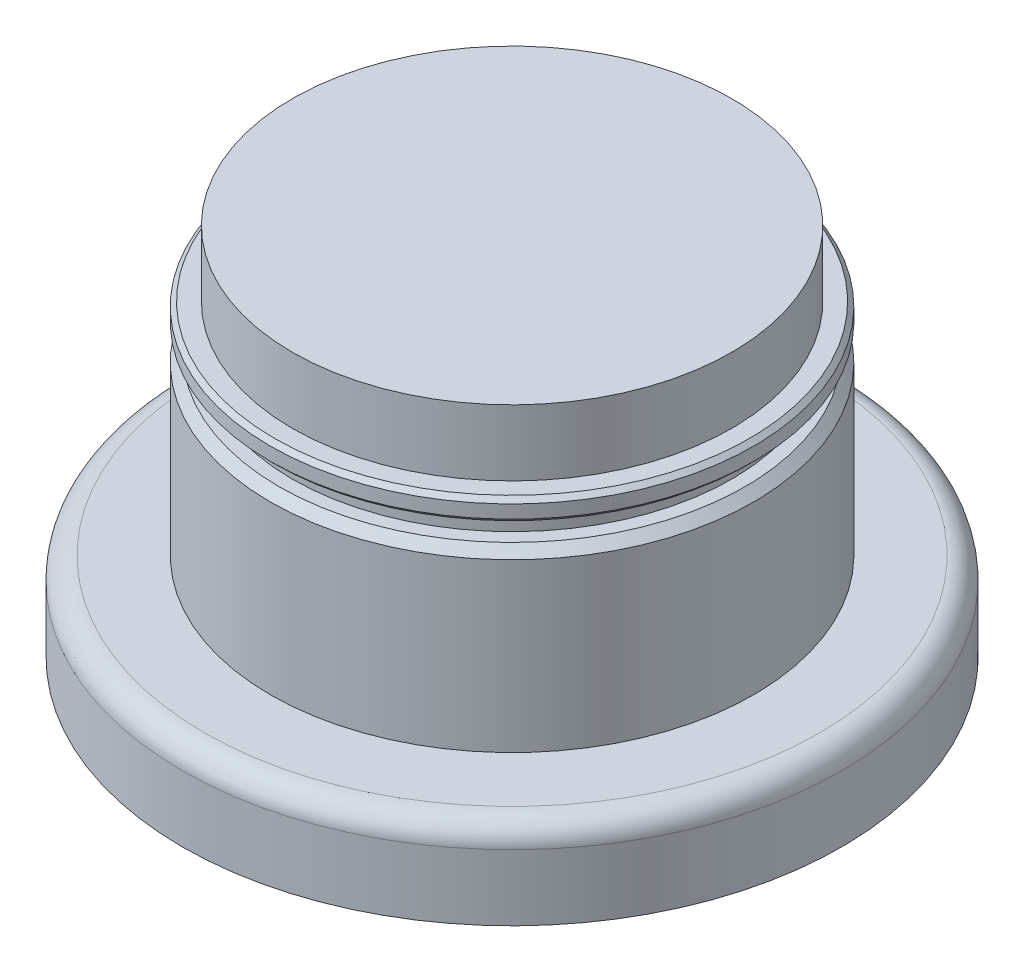
from build123d import *

# Parameters (mm, degrees)
SKETCH2_R           = 75
BOSS_EXTRUDE1_DEPTH = 20
FILLET1_R           = 5
SKETCH6_R           = 55
BOSS_EXTRUDE4_DEPTH = 40
SKETCH7_R           = 50
BOSS_EXTRUDE5_DEPTH = 5
SKETCH8_R           = 55
BOSS_EXTRUDE7_DEPTH = 5
SKETCH10_R          = 50
BOSS_EXTRUDE8_DEPTH = 15
CHAMFER7_SIZE       = 1
CHAMFER8_SIZE       = 2


with BuildPart() as part:
    # Sketch2 → Boss-Extrude1 (new body)
    with BuildSketch(Plane(origin=(0, 0, 0), x_dir=(1, 0, 0), z_dir=(0, 1, 0))):
        with Locations(Location((0, 0, 0), (0, 0, 270))):
            Circle(SKETCH2_R)
    extrude(amount=BOSS_EXTRUDE1_DEPTH)

    # Fillet1
    fillet1_edges = [part.edges().sort_by_distance(p)[0] for p in [
        (0, 20, -75),
    ]]
    fillet(fillet1_edges, radius=FILLET1_R)

    # Sketch6 → Boss-Extrude4 (add)
    with BuildSketch(Plane(origin=(0, 20, 0), x_dir=(1, 0, 0), z_dir=(0, 1, 0))):
        with Locations(Location((0, 0, 0), (0, 0, 270))):
            Circle(SKETCH6_R)
    extrude(amount=BOSS_EXTRUDE4_DEPTH)

    # Sketch7 → Boss-Extrude5 (add)
    with BuildSketch(Plane(origin=(0, 60, 0), x_dir=(1, 0, 0), z_dir=(0, 1, 0))):
        with Locations(Location((0, 0, 0), (0, 0, 270))):
            Circle(SKETCH7_R)
    extrude(amount=BOSS_EXTRUDE5_DEPTH)

    # Sketch8 → Boss-Extrude7 (add)
    with BuildSketch(Plane(origin=(0, 65, 0), x_dir=(1, 0, 0), z_dir=(0, 1, 0))):
        with Locations(Location((0, 0, 0), (0, 0, 270))):
            Circle(SKETCH8_R)
    extrude(amount=BOSS_EXTRUDE7_DEPTH)

    # Sketch10 → Boss-Extrude8 (add)
    with BuildSketch(Plane(origin=(0, 70, 0), x_dir=(1, 0, 0), z_dir=(0, 1, 0))):
        with Locations(Location((0, 0, 0), (0, 0, 270))):
            Circle(SKETCH10_R)
    extrude(amount=BOSS_EXTRUDE8_DEPTH)

    # Chamfer7
    chamfer7_edges = [part.edges().sort_by_distance(p)[0] for p in [
        (0, 65, -55),
        (0, 70, -55),
    ]]
    chamfer(chamfer7_edges, length=CHAMFER7_SIZE)

    # Chamfer8
    chamfer8_edges = [part.edges().sort_by_distance(p)[0] for p in [
        (0, 60, -55),
    ]]
    chamfer(chamfer8_edges, length=CHAMFER8_SIZE)


solid = part.part
